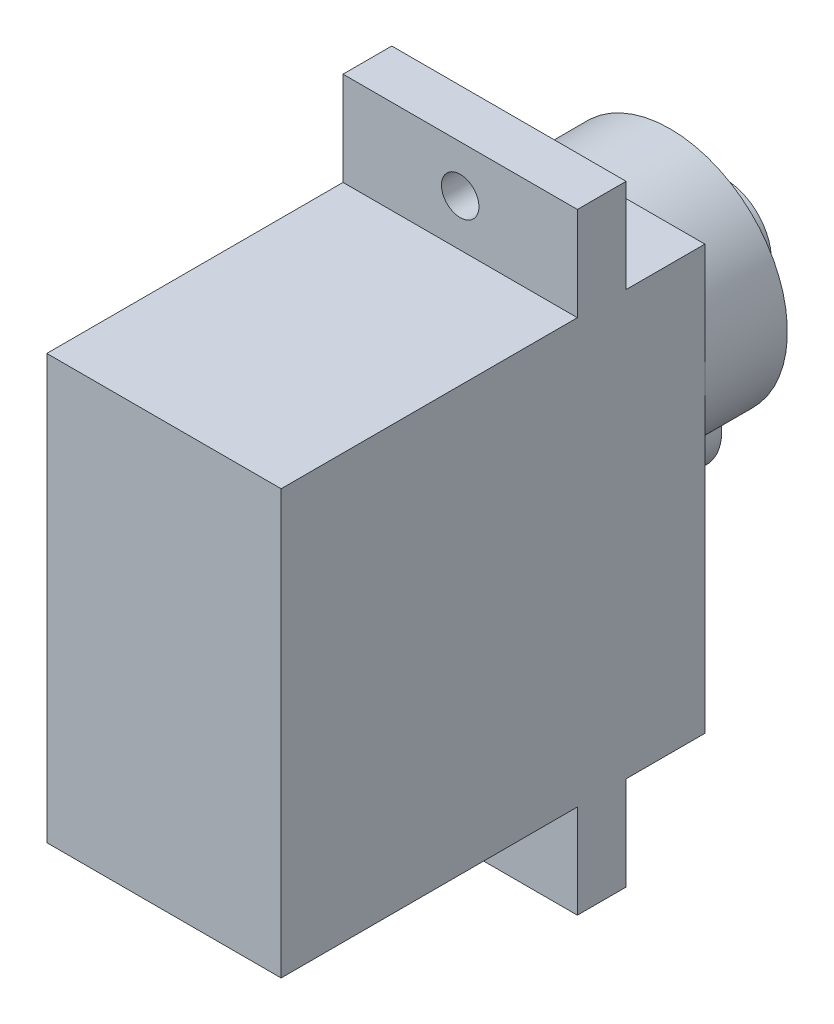
from build123d import *

# Parameters (mm, degrees)
BOSS_EXTRUDE1_DEPTH = 12.5
BOSS_EXTRUDE2_DEPTH = 4.4
SKETCH3_R           = 2.5
BOSS_EXTRUDE3_DEPTH = 2.9
SKETCH4_R           = 1
CUT_EXTRUDE1_DEPTH  = 40.466061369


with BuildPart() as part:
    # Sketch1 → Boss-Extrude1 (new body)
    with BuildSketch(Plane(origin=(0, 0, 0), x_dir=(0, 0, -1), z_dir=(1, 0, 0))):
        Polygon((0, 0), (0, 5), (-15.8, 5), (-15.8, 27.6), (0, 27.6), (0, 32.6), (2.6, 32.6), (2.6, 27.6), (6.8, 27.6), (6.8, 5), (2.6, 5), (2.6, 0), align=None)
    extrude(amount=BOSS_EXTRUDE1_DEPTH)

    # Sketch2 → Boss-Extrude2 (add)
    with BuildSketch(Plane(origin=(0, 0, -6.8), x_dir=(-1, 0, 0), z_dir=(0, 0, -1))):
        with BuildLine():
            ThreePointArc((-8.910810534, 15.694685039), (-6.25, 27.6), (-3.589189466, 15.694685039))
            ThreePointArc((-3.589189466, 15.694685039), (-6.25, 12.25), (-8.910810534, 15.694685039))
        make_face()
    extrude(amount=BOSS_EXTRUDE2_DEPTH)

    # Sketch3 → Boss-Extrude3 (add)
    with BuildSketch(Plane(origin=(0, 0, -11.2), x_dir=(-1, 0, 0), z_dir=(0, 0, -1))):
        with Locations(Location((-6.25, 21.35, 0), (0, 0, 90))):
            Circle(SKETCH3_R)
    extrude(amount=BOSS_EXTRUDE3_DEPTH)

    # Sketch4 → Cut-Extrude1 (cut, through all)
    with BuildSketch(Plane(origin=(0, 0, -2.6), x_dir=(-1, 0, 0), z_dir=(0, 0, -1))):
        with Locations(Location((-6.25, 30.1, 0), (0, 0, 90))):
            Circle(SKETCH4_R)
        with Locations(Location((-6.25, 2.5, 0), (0, 0, 90))):
            Circle(SKETCH4_R)
    extrude(amount=-CUT_EXTRUDE1_DEPTH, mode=Mode.SUBTRACT)


solid = part.part
